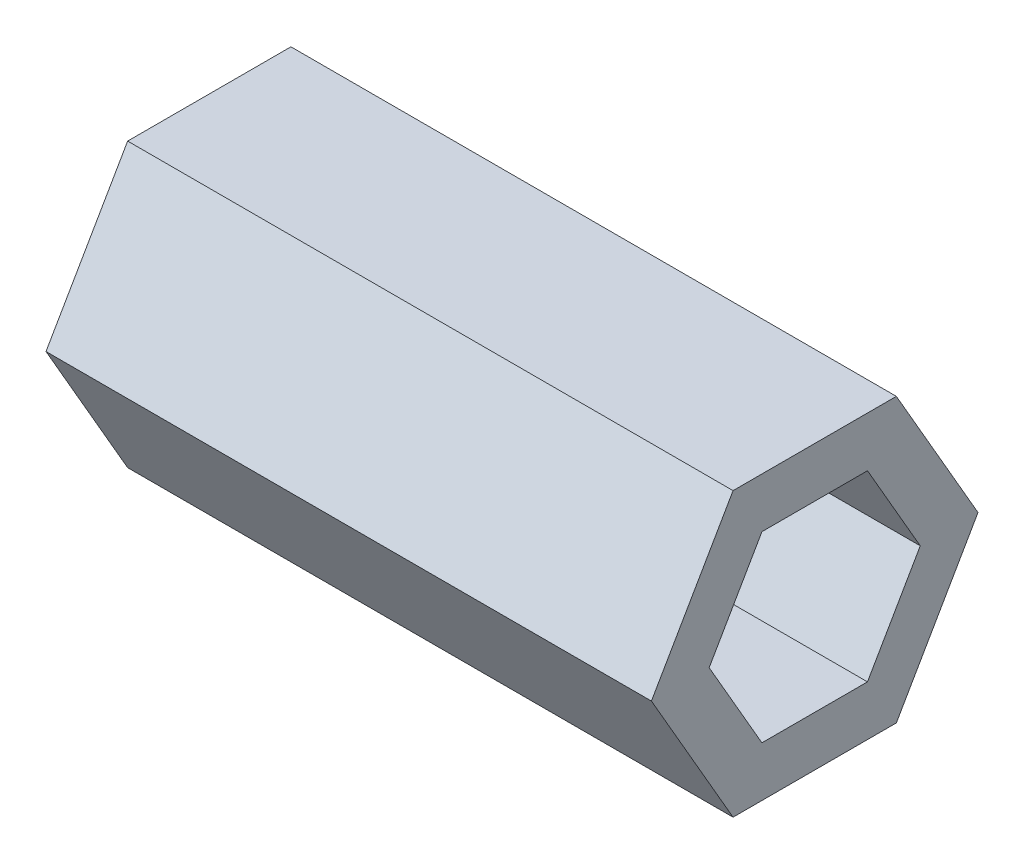
from build123d import *

# Parameters (mm, degrees)
BOSS_EXTRUDE5_DEPTH = 25.4
BOSS_EXTRUDE6_DEPTH = 22.86
CUT_EXTRUDE2_DEPTH  = 10.16
CUT_EXTRUDE4_DEPTH  = 10.16


with BuildPart() as part:
    # Sketch5 → Boss-Extrude5 (new body)
    with BuildSketch(Plane(origin=(0, 0, 0), x_dir=(0, 0, -1), z_dir=(1, 0, 0))):
        Polygon((4, 0), (2, 3.464101615), (-2, 3.464101615), (-4, 0), (-2, -3.464101615), (2, -3.464101615), align=None)
    extrude(amount=BOSS_EXTRUDE5_DEPTH)

    # Sketch7 → Boss-Extrude6 (add)
    with BuildSketch(Plane(origin=(25.4, 0, 0), x_dir=(0, 0, -1), z_dir=(1, 0, 0))):
        Polygon((6.165569463, 0), (3.082784731, 5.339539784), (-3.082784731, 5.339539784), (-6.165569463, 0), (-3.082784731, -5.339539784), (3.082784731, -5.339539784), align=None)
    extrude(amount=-BOSS_EXTRUDE6_DEPTH)

    # Sketch8 → Cut-Extrude2 (cut)
    with BuildSketch(Plane.ZY):
        Polygon((4, 0), (2, 3.464101615), (-2, 3.464101615), (-4, 0), (-2, -3.464101615), (2, -3.464101615), align=None)
    extrude(amount=-CUT_EXTRUDE2_DEPTH, mode=Mode.SUBTRACT)

    # Sketch12 → Cut-Extrude4 (cut)
    with BuildSketch(Plane(origin=(25.4, 0, 0), x_dir=(0, 0, -1), z_dir=(1, 0, 0))):
        Polygon((1.992845787, 3.451710154), (-1.992845787, 3.451710154), (-3.985691573, 0), (-1.992845787, -3.451710154), (1.992845787, -3.451710154), (3.985691573, 0), align=None)
    extrude(amount=-CUT_EXTRUDE4_DEPTH, mode=Mode.SUBTRACT)


solid = part.part
